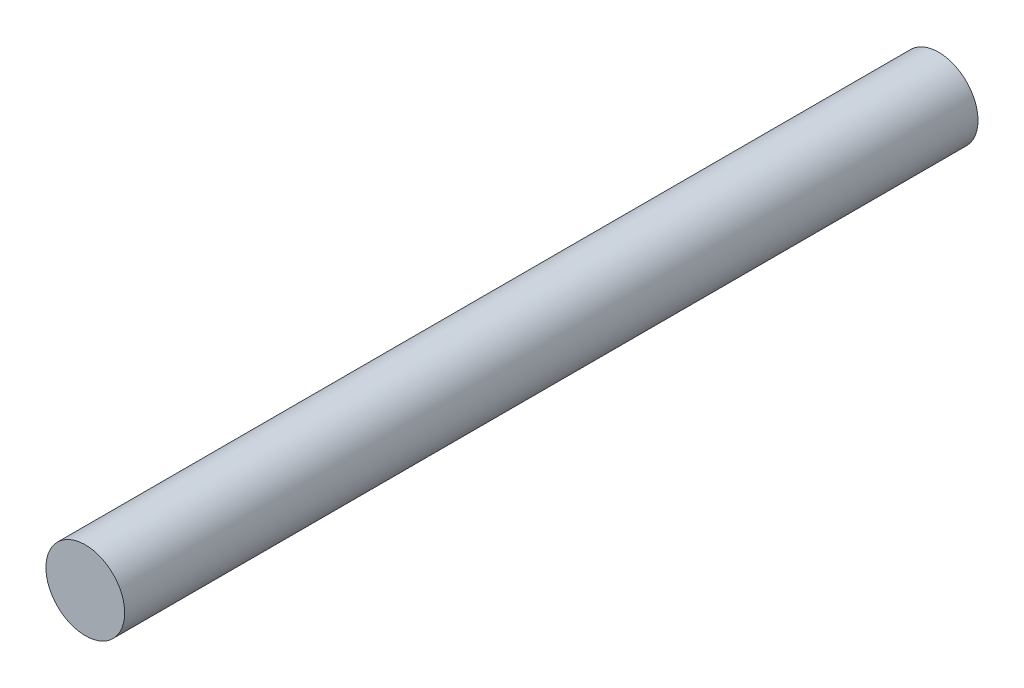
from build123d import *

# Parameters (mm, degrees)
SKETCH1_R           = 3
BOSS_EXTRUDE1_DEPTH = 32.5


with BuildPart() as part:
    # Sketch1 → Boss-Extrude1 (new, symmetric)
    with BuildSketch(Plane.XY):
        Circle(SKETCH1_R)
    extrude(amount=BOSS_EXTRUDE1_DEPTH, both=True)


solid = part.part
